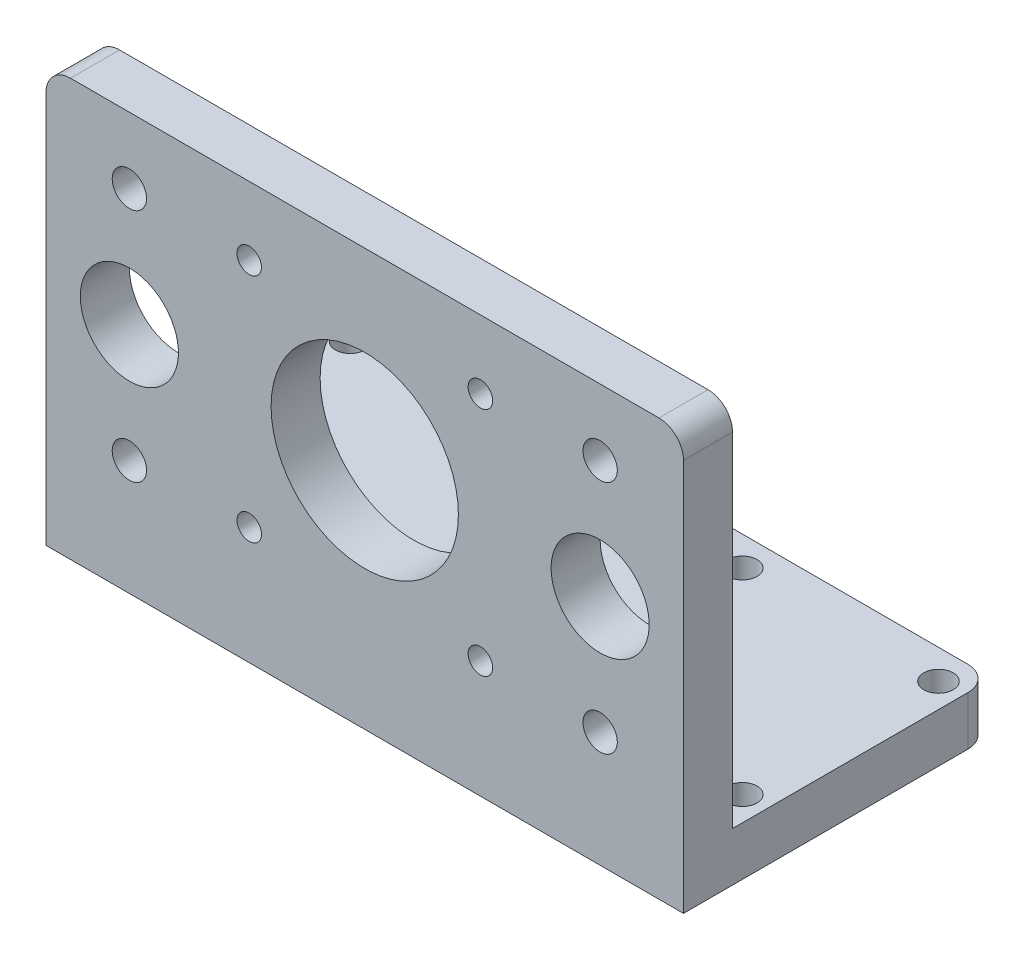
from build123d import *

# Parameters (mm, degrees)
SKETCH1_R           = 3
SKETCH1_W           = 130
SKETCH1_H           = 10
BOSS_EXTRUDE1_DEPTH = 10
SKETCH2_W           = 130
SKETCH2_H           = 8.023003322
BOSS_EXTRUDE2_DEPTH = 75
FILLET1_R           = 5
SKETCH3_W           = 130
SKETCH3_H           = 8.023003322
CUT_EXTRUDE1_DEPTH  = 75
SKETCH4_W           = 130
SKETCH4_H           = 10
CUT_EXTRUDE2_DEPTH  = 37
SKETCH5_W           = 130
SKETCH5_H           = 10
BOSS_EXTRUDE4_DEPTH = 75
FILLET2_R           = 5
SKETCH6_R           = 10
SKETCH6_R_2         = 7.5
SKETCH6_R_3         = 3.5
SKETCH6_R_4         = 2.5
CUT_EXTRUDE3_DEPTH  = 10
SKETCH7_R           = 19.1
CUT_EXTRUDE4_DEPTH  = 10
SKETCH8_R           = 3.5
BOSS_EXTRUDE5_DEPTH = 10


with BuildPart() as part:
    # Sketch1 → Boss-Extrude1 (new body)
    # profile 1 of 3: a face of its own
    with BuildSketch(Plane(origin=(0, 0, 0), x_dir=(1, 0, 0), z_dir=(0, 1, 0))):
        Polygon((0, 63), (0, 0), (5, 0), (130, 0), (130, 63), align=None)
        with Locations(Location((5, 17, 0), (0, 0, 270))):
            Circle(SKETCH1_R, mode=Mode.SUBTRACT)
        with Locations(Location((45, 17, 0), (0, 0, 270))):
            Circle(SKETCH1_R, mode=Mode.SUBTRACT)
        with Locations(Location((5, 57, 0), (0, 0, 270))):
            Circle(SKETCH1_R, mode=Mode.SUBTRACT)
        with Locations(Location((45, 57, 0), (0, 0, 270))):
            Circle(SKETCH1_R, mode=Mode.SUBTRACT)
        with Locations(Location((85, 17, 0), (0, 0, 270))):
            Circle(SKETCH1_R, mode=Mode.SUBTRACT)
        with Locations(Location((125, 17, 0), (0, 0, 270))):
            Circle(SKETCH1_R, mode=Mode.SUBTRACT)
        with Locations(Location((85, 57, 0), (0, 0, 270))):
            Circle(SKETCH1_R, mode=Mode.SUBTRACT)
        with Locations(Location((125, 57, 0), (0, 0, 270))):
            Circle(SKETCH1_R, mode=Mode.SUBTRACT)
    # profile 2 of 3: a face of its own
    with BuildSketch(Plane(origin=(0, 0, 0), x_dir=(1, 0, 0), z_dir=(0, 1, 0))):
        Polygon((5, 0), (0, 0), (0, -27), (130, -27), (130, 0), align=None)
    # profile 3 of 3: a face of its own
    with BuildSketch(Plane(origin=(0, 0, 0), x_dir=(1, 0, 0), z_dir=(0, 1, 0))):
        with Locations((65, -32)):
            Rectangle(SKETCH1_W, SKETCH1_H)
    extrude(amount=BOSS_EXTRUDE1_DEPTH)

    # Sketch2 → Boss-Extrude2 (add)
    with BuildSketch(Plane(origin=(0, 10, 0), x_dir=(1, 0, 0), z_dir=(0, 1, 0))):
        with Locations((65, -32.988498339)):
            Rectangle(SKETCH2_W, SKETCH2_H)
    extrude(amount=BOSS_EXTRUDE2_DEPTH)

    # Fillet1
    fillet1_edges = [part.edges().sort_by_distance(p)[0] for p in [
        (0, 85, 32.988498339),
        (130, 85, 32.988498339),
        (130, 5, -63),
        (0, 5, -63),
    ]]
    fillet(fillet1_edges, radius=FILLET1_R)

    # Sketch3 → Cut-Extrude1 (cut)
    with BuildSketch(Plane(origin=(0, 85, 0), x_dir=(1, 0, 0), z_dir=(0, 1, 0))):
        with Locations((65, -32.988498339)):
            Rectangle(SKETCH3_W, SKETCH3_H)
    extrude(amount=-CUT_EXTRUDE1_DEPTH, mode=Mode.SUBTRACT)

    # Sketch4 → Cut-Extrude2 (cut)
    with BuildSketch(Plane.XY.offset(37)):
        with Locations((65, 5)):
            Rectangle(SKETCH4_W, SKETCH4_H)
    extrude(amount=-CUT_EXTRUDE2_DEPTH, mode=Mode.SUBTRACT)

    # Sketch5 → Boss-Extrude4 (add)
    with BuildSketch(Plane(origin=(0, 10, 0), x_dir=(1, 0, 0), z_dir=(0, 1, 0))):
        with Locations((65, 5)):
            Rectangle(SKETCH5_W, SKETCH5_H)
    extrude(amount=BOSS_EXTRUDE4_DEPTH)

    # Fillet2
    fillet2_edges = [part.edges().sort_by_distance(p)[0] for p in [
        (130, 85, -5),
        (0, 85, -5),
    ]]
    fillet(fillet2_edges, radius=FILLET2_R)

    # Sketch6 → Cut-Extrude3 (cut)
    with BuildSketch(Plane(origin=(0, 0, -10), x_dir=(-1, 0, 0), z_dir=(0, 0, -1))):
        with Locations((-113, 47.5)):
            Circle(SKETCH6_R)
        with Locations((-65, 47.5)):
            Circle(SKETCH6_R_2)
        with Locations((-17, 47.5)):
            Circle(SKETCH6_R)
        with Locations((-113, 71.5)):
            Circle(SKETCH6_R_3)
        with Locations((-65, 74.04)):
            Circle(SKETCH6_R_3)
        with Locations((-17, 71.5)):
            Circle(SKETCH6_R_3)
        with Locations((-17, 23.5)):
            Circle(SKETCH6_R_3)
        with Locations((-65, 21)):
            Circle(SKETCH6_R_3)
        with Locations((-113, 23.5)):
            Circle(SKETCH6_R_3)
        with Locations((-88.58, 71.06)):
            Circle(SKETCH6_R_4)
        with Locations((-41.44, 71.06)):
            Circle(SKETCH6_R_4)
        with Locations((-41.44, 23.92)):
            Circle(SKETCH6_R_4)
        with Locations((-88.58, 23.92)):
            Circle(SKETCH6_R_4)
    extrude(amount=-CUT_EXTRUDE3_DEPTH, mode=Mode.SUBTRACT)

    # Sketch7 → Cut-Extrude4 (cut)
    with BuildSketch(Plane(origin=(0, 0, -10), x_dir=(-1, 0, 0), z_dir=(0, 0, -1))):
        with Locations((-65, 47.5)):
            Circle(SKETCH7_R)
    extrude(amount=-CUT_EXTRUDE4_DEPTH, mode=Mode.SUBTRACT)

    # Sketch8 → Boss-Extrude5 (add)
    with BuildSketch(Plane(origin=(0, 0, -10), x_dir=(-1, 0, 0), z_dir=(0, 0, -1))):
        with Locations((-65, 74.04)):
            Circle(SKETCH8_R)
        with Locations((-65, 21)):
            Circle(SKETCH8_R)
    extrude(amount=-BOSS_EXTRUDE5_DEPTH)


solid = part.part
